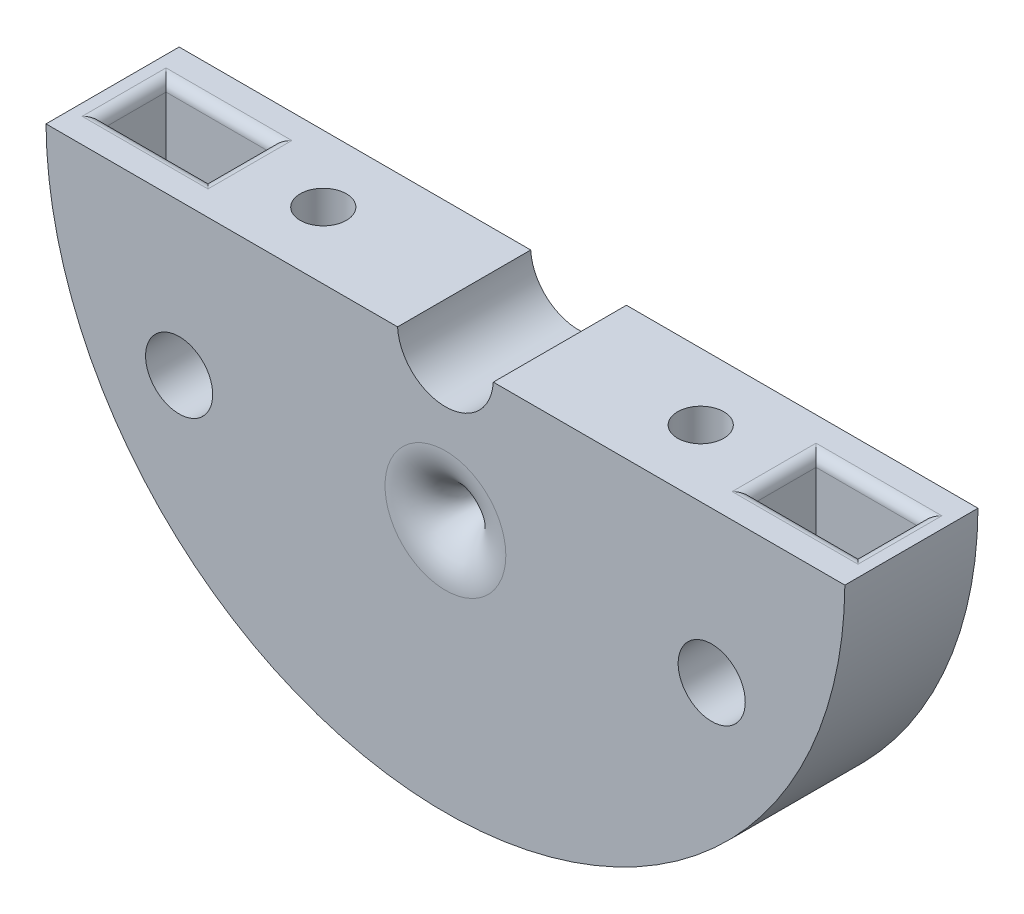
from build123d import *

# Parameters (mm, degrees)
SKETCH1_R                     = 19.05
SKETCH1_R_2                   = 0.5
BOSS_EXTRUDE1_DEPTH           = 6.35
M3_CLEARANCE_HOLE1_D          = 3.2
M3_CLEARANCE_HOLE1_DEPTH      = 29.72
M3_CLEARANCE_HOLE1_TIP        = 0.96137699
SKETCH4_W                     = 38.1
SKETCH4_H                     = 0.25
CUT_EXTRUDE1_DEPTH            = 28.679008291
CBORE_FOR_M2_SHCS1_AT_2_COUNT = 2
CBORE_FOR_M2_SHCS1_AT_2_PITCH = 18
CUT_EXTRUDE2_DEPTH            = 15
FILLET1_R                     = 2.38125
SKETCH12_W                    = 55.779861043
SKETCH12_H                    = 26.707675132
CUT_EXTRUDE3_DEPTH            = 28.678726197
SKETCH13_W                    = 5
SKETCH13_H                    = 3
CUT_EXTRUDE4_DEPTH            = 5
FILLET4_R                     = 0.5


with BuildPart() as part:
    # Sketch1 → Boss-Extrude1 (new body)
    with BuildSketch(Plane.XY):
        Circle(SKETCH1_R)
        with Locations((-6.049187445, 3.4925)):
            Circle(SKETCH1_R_2, mode=Mode.SUBTRACT)
        with Locations((6.049187445, 3.4925)):
            Circle(SKETCH1_R_2, mode=Mode.SUBTRACT)
        with Locations((0, -6.985)):
            Circle(SKETCH1_R_2, mode=Mode.SUBTRACT)
        with BuildLine():
            ThreePointArc((2.286, 0), (0, 2.286), (-2.286, 0))
            ThreePointArc((-2.286, 0), (0, -2.286), (2.286, 0))
        make_face(mode=Mode.SUBTRACT)
    extrude(amount=BOSS_EXTRUDE1_DEPTH)

    # M3 Clearance Hole1
    with Locations(Plane(origin=(-15.665967818, 20.219646462, 6.35), x_dir=(1, 0, 0), z_dir=(0, 0, 1))):
        with Locations((15.665967818, -5.554949625), (2.965967818, -27.551994881), (28.365967818, -27.551994881)):
            Hole(M3_CLEARANCE_HOLE1_D / 2, depth=M3_CLEARANCE_HOLE1_DEPTH)
            with Locations((0, 0, -(M3_CLEARANCE_HOLE1_DEPTH + M3_CLEARANCE_HOLE1_TIP / 2))):  # 118° drill point
                Cone(0, M3_CLEARANCE_HOLE1_D / 2, M3_CLEARANCE_HOLE1_TIP, mode=Mode.SUBTRACT)

    # Sketch4 → Cut-Extrude1 (cut, through all)
    with BuildSketch(Plane(origin=(0, 0, 0), x_dir=(-1, 0, 0), z_dir=(0, 0, -1))):
        Rectangle(SKETCH4_W, SKETCH4_H)
    extrude(amount=-CUT_EXTRUDE1_DEPTH, mode=Mode.SUBTRACT)


with BuildPart() as cut_extrude1_piece_1:
    # of the separate pieces the step leaves, piece 1, a body of its own (cut_extrude1_pieces)
    add(part.part.solids().sort_by_distance((19.049589891, 0.125, 0))[0])


with BuildPart() as cut_extrude1_piece_2:
    # of the separate pieces the step leaves, piece 2, a body of its own (cut_extrude1_pieces)
    add(part.part.solids().sort_by_distance((-19.049589891, -0.125, 0))[0])


with BuildPart() as cbore_for_m2_shcs1_tool:
    # Sketch9 → CBORE for M2 SHCS1 (revolve)
    with BuildSketch(Plane(origin=(-9, 19.05, 3.175), x_dir=(0, 0, 1), z_dir=(1, 0, 0))):
        Polygon((0, 0), (0, 38.1), (1.1, 38.1), (1.1, 2), (2.2, 2), (2.2, 0), align=None)
    cbore_for_m2_shcs1 = revolve(axis=Axis((-9, 25.4, 3.175), (0, -1, 0)))


with BuildPart() as cut_extrude1_piece_1_1:
    add(cut_extrude1_piece_1.part)

    # CBORE for M2 SHCS1: cut by cbore_for_m2_shcs1_tool
    add(cbore_for_m2_shcs1_tool.part, mode=Mode.SUBTRACT)


with BuildPart() as cut_extrude1_piece_2_1:
    add(cut_extrude1_piece_2.part)

    # CBORE for M2 SHCS1: cut by cbore_for_m2_shcs1_tool
    add(cbore_for_m2_shcs1_tool.part, mode=Mode.SUBTRACT)


with BuildPart() as cbore_for_m2_shcs1_at_2_tool:
    # CBORE for M2 SHCS1 at 2: CBORE for M2 SHCS1 ×2
    with Locations(*[(i * CBORE_FOR_M2_SHCS1_AT_2_PITCH, 0, 0) for i in range(1, CBORE_FOR_M2_SHCS1_AT_2_COUNT)]):
        add(cbore_for_m2_shcs1)


with BuildPart() as cut_extrude1_piece_1_2:
    add(cut_extrude1_piece_1_1.part)

    # CBORE for M2 SHCS1 at 2: cut by cbore_for_m2_shcs1_at_2_tool
    add(cbore_for_m2_shcs1_at_2_tool.part, mode=Mode.SUBTRACT)

    # Sketch12 → Cut-Extrude3 (cut, through all)
    with BuildSketch(Plane.XY):
        with Locations((0.042756797, 13.353837566)):
            Rectangle(SKETCH12_W, SKETCH12_H)
    extrude(amount=CUT_EXTRUDE3_DEPTH, mode=Mode.SUBTRACT)


with BuildPart() as cut_extrude1_piece_2_2:
    add(cut_extrude1_piece_2_1.part)

    # CBORE for M2 SHCS1 at 2: cut by cbore_for_m2_shcs1_at_2_tool
    add(cbore_for_m2_shcs1_at_2_tool.part, mode=Mode.SUBTRACT)

    # Sketch11 → Cut-Extrude2 (cut)
    with BuildSketch(Plane.XZ.offset(19.05)):
        Polygon((-10.154700538, 5.175), (-11.309401077, 3.175), (-10.154700538, 1.175), (-7.845299462, 1.175), (-6.690598923, 3.175), (-7.845299462, 5.175), align=None)
        Polygon((7.845299462, 5.175), (6.690598923, 3.175), (7.845299462, 1.175), (10.154700538, 1.175), (11.309401077, 3.175), (10.154700538, 5.175), align=None)
    extrude(amount=-CUT_EXTRUDE2_DEPTH, mode=Mode.SUBTRACT)

    # Fillet1
    fillet1_edges = [cut_extrude1_piece_2_2.edges().sort_by_distance(p)[0] for p in [
        (-0.5, -6.985, 0),
        (-0.5, -6.985, 6.35),
    ]]
    fillet(fillet1_edges, radius=FILLET1_R)

    # Sketch13 → Cut-Extrude4 (cut)
    with BuildSketch(Plane(origin=(0, -0.125, 0), x_dir=(1, 0, 0), z_dir=(0, 1, 0))):
        with Locations((-15.5, -3.175)):
            Rectangle(SKETCH13_W, SKETCH13_H)
        with Locations((15.5, -3.175)):
            Rectangle(SKETCH13_W, SKETCH13_H)
    extrude(amount=-CUT_EXTRUDE4_DEPTH, mode=Mode.SUBTRACT)

    # Fillet4
    fillet4_edges = [cut_extrude1_piece_2_2.edges().sort_by_distance(p)[0] for p in [
        (18, -0.125, 3.175),
        (15.5, -0.125, 1.675),
        (13, -0.125, 3.175),
        (15.5, -0.125, 4.675),
        (-15.5, -0.125, 1.675),
        (-18, -0.125, 3.175),
        (-15.5, -0.125, 4.675),
        (-13, -0.125, 3.175),
    ]]
    fillet(fillet4_edges, radius=FILLET4_R)


solid = cut_extrude1_piece_2_2.part
